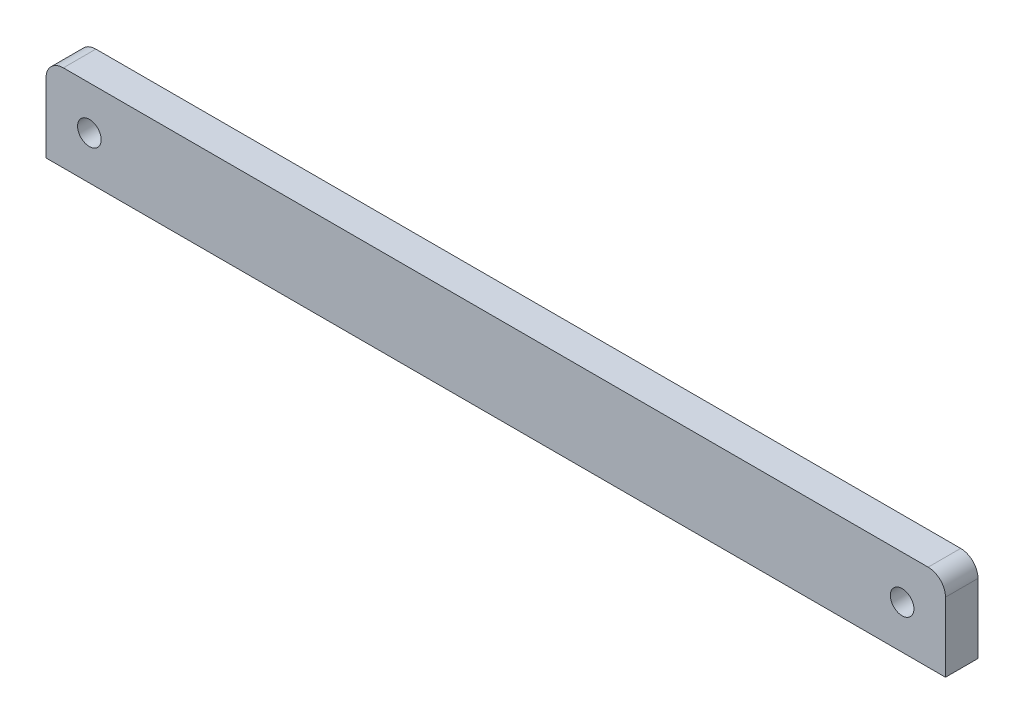
from build123d import *

# Parameters (mm, degrees)
SKETCH1_W           = 131.7498
SKETCH1_H           = 12.7
SKETCH1_R           = 1.7272
BOSS_EXTRUDE1_DEPTH = 4.7625
FILLET1_R           = 2.54


with BuildPart() as part:
    # Sketch1 → Boss-Extrude1 (new body)
    with BuildSketch(Plane.XY):
        with Locations((38.881044974, 45.895610345)):
            Rectangle(SKETCH1_W, SKETCH1_H)
        with Locations(Location((-20.643855026, 45.895610345, 0), (0, 0, 180))):
            Circle(SKETCH1_R, mode=Mode.SUBTRACT)
        with Locations(Location((98.405944974, 45.895610345, 0), (0, 0, 180))):
            Circle(SKETCH1_R, mode=Mode.SUBTRACT)
    extrude(amount=BOSS_EXTRUDE1_DEPTH)

    # Fillet1
    fillet1_edges = [part.edges().sort_by_distance(p)[0] for p in [
        (-26.993855026, 52.245610345, 2.38125),
        (104.755944974, 52.245610345, 2.38125),
    ]]
    fillet(fillet1_edges, radius=FILLET1_R)


solid = part.part
